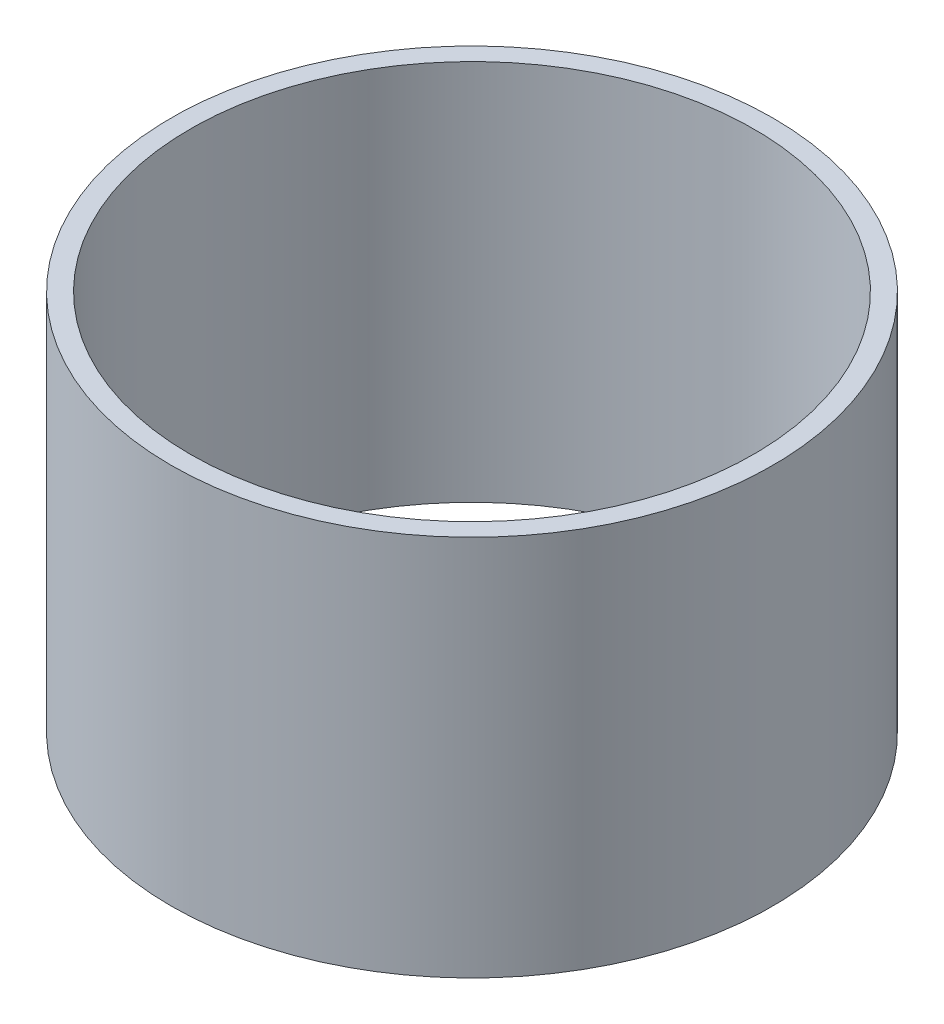
from build123d import *

# Parameters (mm, degrees)
SKETCH1_R           = 40.04
SKETCH1_R_2         = 37.5
BOSS_EXTRUDE1_DEPTH = 50.8


with BuildPart() as part:
    # Sketch1 → Boss-Extrude1 (new body)
    with BuildSketch(Plane(origin=(0, 0, 0), x_dir=(1, 0, 0), z_dir=(0, 1, 0))):
        with Locations(Location((0, 0, 0), (0, 0, 270))):
            Circle(SKETCH1_R)
        with Locations(Location((0, 0, 0), (0, 0, 270))):
            Circle(SKETCH1_R_2, mode=Mode.SUBTRACT)
    extrude(amount=BOSS_EXTRUDE1_DEPTH)


solid = part.part
